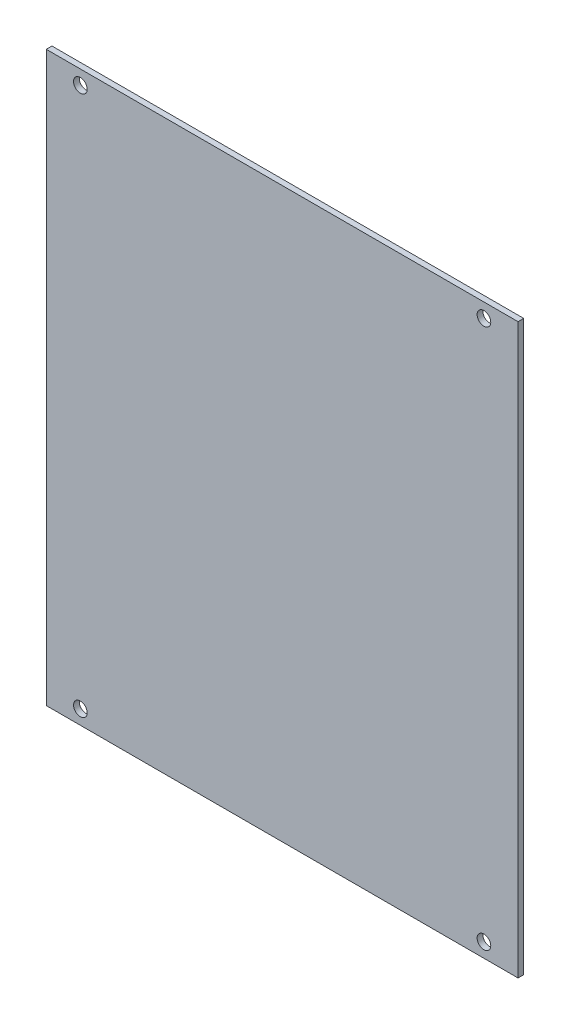
from build123d import *

# Parameters (mm, degrees)
SKETCH1_W           = 83
SKETCH1_H           = 100
BOSS_EXTRUDE1_DEPTH = 0.5
M2_HOLE1_A_D        = 2.4


with BuildPart() as part:
    # Sketch1 → Boss-Extrude1 (new, symmetric)
    with BuildSketch(Plane.XY):
        Rectangle(SKETCH1_W, SKETCH1_H)
    extrude(amount=BOSS_EXTRUDE1_DEPTH, both=True)

    # M2 Hole1 - A (through all)
    with Locations(Plane.XY.offset(0.5)):
        with Locations((-35.5, 47.5), (35.5, 47.5), (-35.5, -47.5), (35.5, -47.5)):
            Hole(M2_HOLE1_A_D / 2)


solid = part.part
